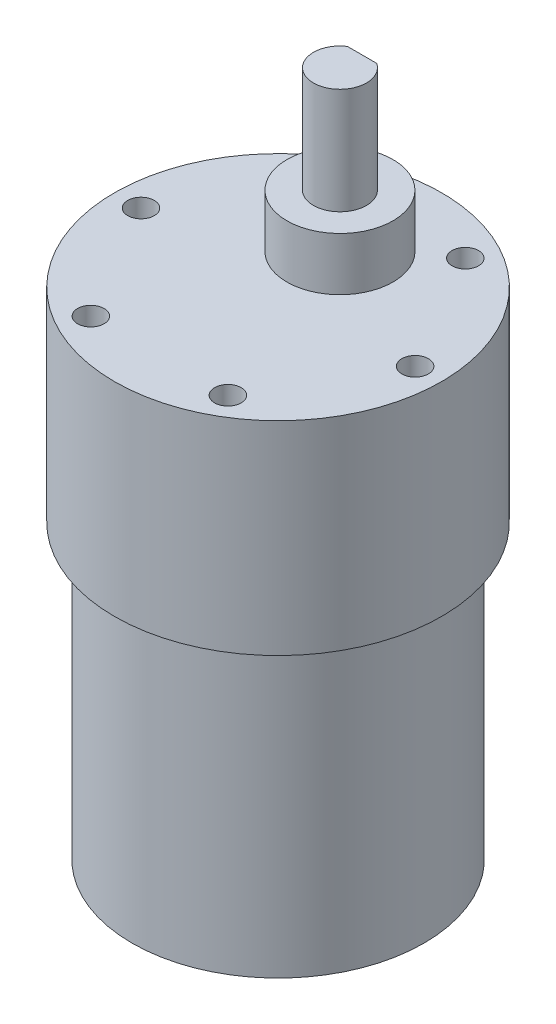
from build123d import *

# Parameters (mm, degrees)
SKETCH_1_R          = 16.5
EXTRUDE_1_DEPTH     = 33
SKETCH_1_3_R        = 18.5
EXTRUDE_2_DEPTH     = 23
SKETCH_3_R          = 1.5
CUT_EXTRUDE_1_DEPTH = 2.5
SKETCH_3_3_R        = 3
EXTRUDE_3_DEPTH     = 18
SKETCH_3_4_R        = 6
EXTRUDE_4_DEPTH     = 6
CUT_EXTRUDE_START   = -12
CUT_EXTRUDE_2_DEPTH = 12


with BuildPart() as part:
    # 草图1 → 凸台-拉伸1 (new body)
    with BuildSketch(Plane(origin=(0, 0, 0), x_dir=(1, 0, 0), z_dir=(0, 1, 0))):
        Circle(SKETCH_1_R)
    extrude(amount=-EXTRUDE_1_DEPTH)

    # 草图1<3> → 凸台-拉伸2 (add)
    with BuildSketch(Plane(origin=(0, 0, 0), x_dir=(1, 0, 0), z_dir=(0, 1, 0))):
        Circle(SKETCH_1_3_R)
    extrude(amount=EXTRUDE_2_DEPTH)

    # 草图3 → 切除-拉伸1 (cut)
    with BuildSketch(Plane(origin=(0, 23, 0), x_dir=(1, 0, 0), z_dir=(0, 1, 0))):
        with Locations((-7.75, 13.423393759)):
            Circle(SKETCH_3_R)
        with Locations((7.75, 13.423393759)):
            Circle(SKETCH_3_R)
        with Locations((15.5, 0)):
            Circle(SKETCH_3_R)
        with Locations((7.75, -13.423393759)):
            Circle(SKETCH_3_R)
        with Locations((-7.75, -13.423393759)):
            Circle(SKETCH_3_R)
        with Locations((-15.5, 0)):
            Circle(SKETCH_3_R)
    extrude(amount=-CUT_EXTRUDE_1_DEPTH, mode=Mode.SUBTRACT)

    # 草图3<3> → 凸台-拉伸3 (add)
    with BuildSketch(Plane(origin=(0, 23, 0), x_dir=(1, 0, 0), z_dir=(0, 1, 0))):
        with Locations((0, 7)):
            Circle(SKETCH_3_3_R)
    extrude(amount=EXTRUDE_3_DEPTH)

    # 草图3<4> → 凸台-拉伸4 (add)
    with BuildSketch(Plane(origin=(0, 23, 0), x_dir=(1, 0, 0), z_dir=(0, 1, 0))):
        with Locations((0, 7)):
            Circle(SKETCH_3_4_R)
    extrude(amount=EXTRUDE_4_DEPTH)

    # 草图4 → 切除-拉伸2 (cut)
    with BuildSketch(Plane(origin=(0, 41, 0), x_dir=(1, 0, 0), z_dir=(0, 1, 0)).offset(CUT_EXTRUDE_START)):
        with BuildLine():
            Line((-1.658312395, 9.5), (1.658312395, 9.5))
            ThreePointArc((1.658312395, 9.5), (0, 10), (-1.658312395, 9.5))
        make_face()
    extrude(amount=CUT_EXTRUDE_2_DEPTH, mode=Mode.SUBTRACT)


solid = part.part
